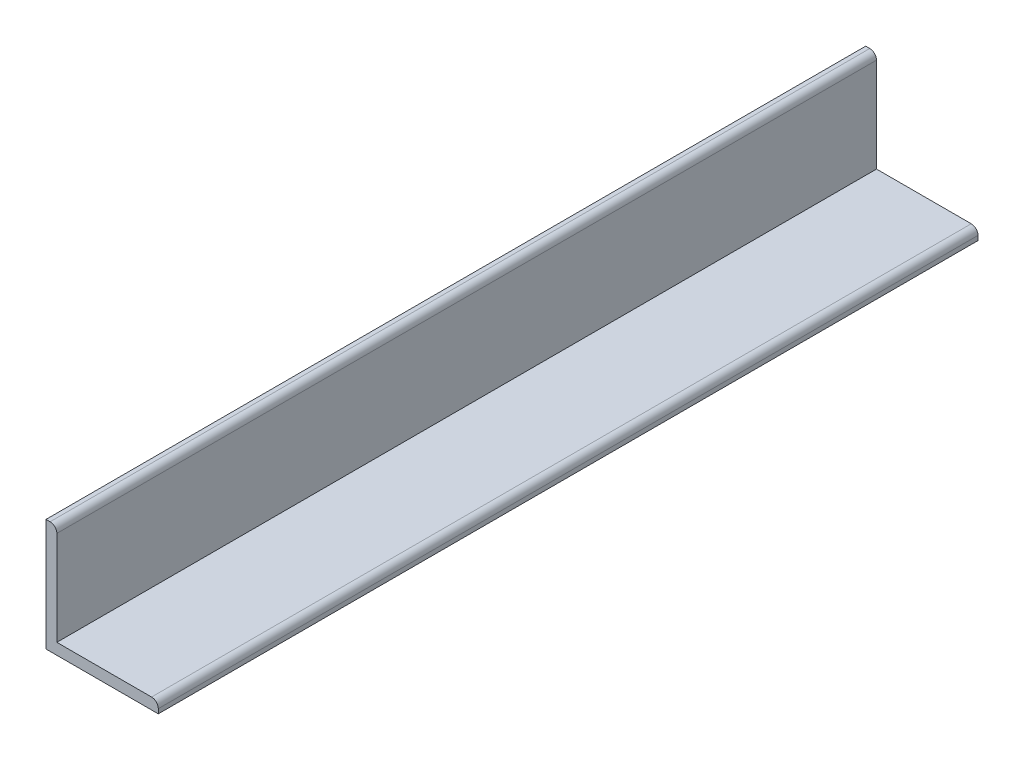
from build123d import *

# Parameters (mm, degrees)
BOSS_EXTRUDE1_DEPTH = 182.5


with BuildPart() as part:
    # Sketch1 → Boss-Extrude1 (new, symmetric)
    with BuildSketch(Plane.XY):
        with BuildLine():
            Line((-19.724600372, 21.546389828), (-19.724600372, -20.453610172))
            Line((-19.724600372, -20.453610172), (22.453610172, -20.453610172))
            ThreePointArc((22.453610172, -20.453610172), (24.574930515, -21.332289828), (25.453610172, -23.453610172))
            Line((25.453610172, -23.453610172), (25.453610172, -25.453610172))
            Line((25.453610172, -25.453610172), (-24.546389828, -25.453610172))
            Line((-24.546389828, -25.453610172), (-24.546389828, 24.546389828))
            Line((-24.546389828, 24.546389828), (-22.724600372, 24.546389828))
            ThreePointArc((-22.724600372, 24.546389828), (-20.603280029, 23.667710172), (-19.724600372, 21.546389828))
        make_face()
    extrude(amount=BOSS_EXTRUDE1_DEPTH, both=True)


solid = part.part
